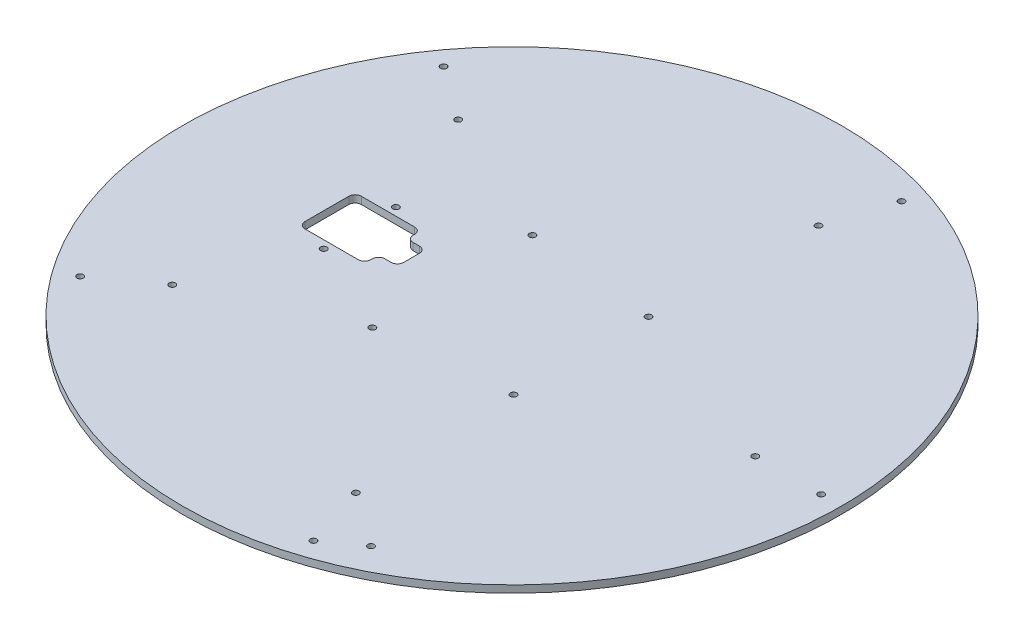
from build123d import *

# Parameters (mm, degrees)
SKETCH1_R                       = 266.7
BOSS_EXTRUDE1_DEPTH             = 5.842
SKETCH2_R                       = 2.5527
HOLES_MOUNTINGPOLARMECH_DEPTH   = 378.215997757
CUTOUT_STEPPERMOTORRELIEF_DEPTH = 378.215997757
FILLET_STEPPERMOTORRELIEF_R     = 5.08
SKETCH4_R                       = 2.5527
HOLES_FEET_DEPTH                = 378.215997757
CIRPATTERN_FEET_COUNT           = 5
SKETCH5_R                       = 2.5527
CUT_EXTRUDE1_DEPTH              = 378.215997757


with BuildPart() as part:
    # Sketch1 → Boss-Extrude1 (new body)
    with BuildSketch(Plane(origin=(0, 0, 0), x_dir=(1, 0, 0), z_dir=(0, 1, 0))):
        Circle(SKETCH1_R)
    extrude(amount=BOSS_EXTRUDE1_DEPTH)

    # Sketch2 → Holes-MountingPolarMech (cut, through all)
    with BuildSketch(Plane(origin=(0, 5.842, 0), x_dir=(1, 0, 0), z_dir=(0, 1, 0))):
        with Locations((55.88, 54.61)):
            Circle(SKETCH2_R)
        with Locations((-48.26, 64.77)):
            Circle(SKETCH2_R)
        with Locations((-48.26, -64.77)):
            Circle(SKETCH2_R)
        with Locations((55.88, -54.61)):
            Circle(SKETCH2_R)
        with Locations((-123.19, 29.21)):
            Circle(SKETCH2_R)
        with Locations((-123.19, -29.21)):
            Circle(SKETCH2_R)
    extrude(amount=-HOLES_MOUNTINGPOLARMECH_DEPTH, mode=Mode.SUBTRACT)

    # Sketch3 → Cutout-StepperMotorRelief (cut, through all)
    with BuildSketch(Plane(origin=(0, 5.842, 0), x_dir=(1, 0, 0), z_dir=(0, 1, 0))):
        Polygon((-123.19, 22.86), (-149.86, 22.86), (-149.86, 0), (-149.86, -22.86), (-123.19, -22.86), (-96.52, -22.86), (-96.52, -11.43), (-81.28, -11.43), (-81.28, 0), (-81.28, 11.43), (-96.52, 11.43), (-96.52, 22.86), align=None)
    extrude(amount=-CUTOUT_STEPPERMOTORRELIEF_DEPTH, mode=Mode.SUBTRACT)

    # Fillet-StepperMotorRelief
    fillet_steppermotorrelief_edges = [part.edges().sort_by_distance(p)[0] for p in [
        (-149.86, 2.921, -22.86),
        (-149.86, 2.921, 22.86),
        (-96.52, 2.921, -22.86),
        (-96.52, 2.921, -11.43),
        (-81.28, 2.921, -11.43),
        (-96.52, 2.921, 11.43),
        (-81.28, 2.921, 11.43),
        (-96.52, 2.921, 22.86),
    ]]
    fillet(fillet_steppermotorrelief_edges, radius=FILLET_STEPPERMOTORRELIEF_R)

    # Sketch4 → Holes-Feet (cut, through all)
    with BuildSketch(Plane(origin=(0, 5.842, 0), x_dir=(1, 0, 0), z_dir=(0, 1, 0))):
        with Locations((250.19, 0)):
            Circle(SKETCH4_R)
        with Locations((196.85, 0)):
            Circle(SKETCH4_R)
    holes_feet = extrude(amount=-HOLES_FEET_DEPTH, mode=Mode.SUBTRACT)

    # CirPattern-Feet: Holes-Feet ×5 about axis
    cirpattern_feet_axis = Axis((0, 6.1341, 0), (0, -1, 0))
    for i in range(1, CIRPATTERN_FEET_COUNT):
        add(holes_feet.rotate(cirpattern_feet_axis, i * 360 / CIRPATTERN_FEET_COUNT), mode=Mode.SUBTRACT)

    # Sketch5 → Cut-Extrude1 (cut, through all)
    with BuildSketch(Plane.XZ):
        with Locations((104.369393552, 218.470806035)):
            Circle(SKETCH5_R)
    extrude(amount=-CUT_EXTRUDE1_DEPTH, mode=Mode.SUBTRACT)


solid = part.part
